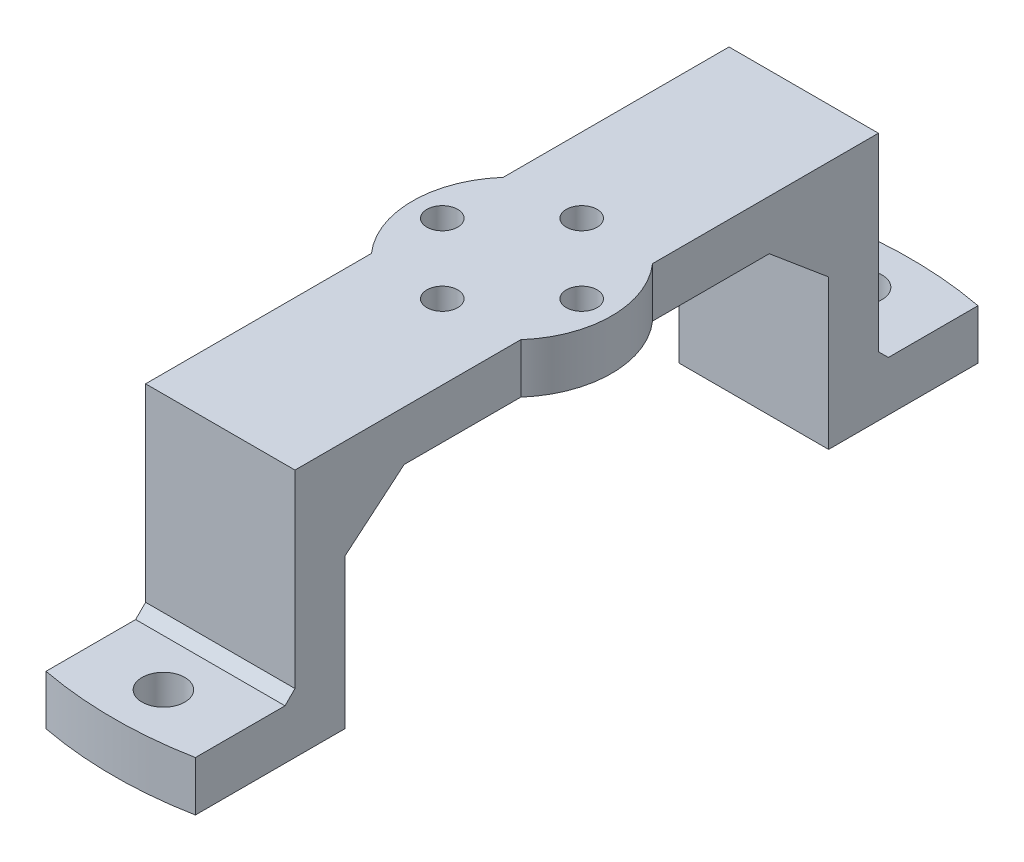
from build123d import *
from OCP.BRepFilletAPI import BRepFilletAPI_MakeChamfer

# Parameters (mm, degrees)
SKETCH1_R             = 2.15
BOSS_EXTRUDE1_DEPTH   = 5
BOSS_EXTRUDE1_2_DEPTH = 5
SKETCH2_W             = 15
SKETCH2_H             = 5
BOSS_EXTRUDE2_DEPTH   = 15
SKETCH3_W             = 15
SKETCH3_H             = 58.581168228
BOSS_EXTRUDE3_DEPTH   = 5
SKETCH4_R             = 10
BOSS_EXTRUDE4_DEPTH   = 5
SKETCH5_R             = 1.55
CUT_EXTRUDE1_DEPTH    = 5
CHAMFER2_SIZE         = 5
CHAMFER2_SIZE2        = 5.958767963
CHAMFER3_SIZE         = 1


with BuildPart() as part:
    # Sketch1 → Boss-Extrude1 (new body)
    with BuildSketch(Plane(origin=(0, 0, 0), x_dir=(1, 0, 0), z_dir=(0, 1, 0))):
        with BuildLine():
            Line((-7.5, -24.290584114), (-7.5, -39.290584114))
            ThreePointArc((-7.5, -39.290584114), (0, -40), (7.5, -39.290584114))
            Line((7.5, -39.290584114), (7.5, -24.290584114))
            Line((7.5, -24.290584114), (-7.5, -24.290584114))
        make_face()
        with Locations(Location((0, -35, 0), (0, 0, 270))):
            Circle(SKETCH1_R, mode=Mode.SUBTRACT)
    extrude(amount=BOSS_EXTRUDE1_DEPTH)



with BuildPart() as body_2:
    # Sketch1 → Boss-Extrude1 2 (new body)
    with BuildSketch(Plane(origin=(0, 0, 0), x_dir=(1, 0, 0), z_dir=(0, 1, 0))):
        with BuildLine():
            Line((-7.5, 39.290584114), (-7.5, 24.290584114))
            Line((-7.5, 24.290584114), (7.5, 24.290584114))
            Line((7.5, 24.290584114), (7.5, 39.290584114))
            ThreePointArc((7.5, 39.290584114), (0, 40), (-7.5, 39.290584114))
        make_face()
        with Locations(Location((0, 35, 0), (0, 0, 270))):
            Circle(SKETCH1_R, mode=Mode.SUBTRACT)
    extrude(amount=BOSS_EXTRUDE1_2_DEPTH)


with BuildPart() as part_1:
    add(part.part)

    add(body_2.part)  # Boss-Extrude2 merges body 2
    # Sketch2 → Boss-Extrude2 (add)
    with BuildSketch(Plane(origin=(0, 5, 0), x_dir=(1, 0, 0), z_dir=(0, 1, 0))):
        with Locations((0, -26.790584114)):
            Rectangle(SKETCH2_W, SKETCH2_H)
        with Locations((0, 26.790584114)):
            Rectangle(SKETCH2_W, SKETCH2_H)
    extrude(amount=BOSS_EXTRUDE2_DEPTH)

    # Sketch3 → Boss-Extrude3 (add)
    with BuildSketch(Plane(origin=(0, 20, 0), x_dir=(1, 0, 0), z_dir=(0, 1, 0))):
        Rectangle(SKETCH3_W, SKETCH3_H)
    extrude(amount=BOSS_EXTRUDE3_DEPTH)

    # Sketch4 → Boss-Extrude4 (add)
    with BuildSketch(Plane(origin=(0, 25, 0), x_dir=(1, 0, 0), z_dir=(0, 1, 0))):
        Circle(SKETCH4_R)
    extrude(amount=-BOSS_EXTRUDE4_DEPTH)

    # Sketch5 → Cut-Extrude1 (cut)
    with BuildSketch(Plane(origin=(0, 25, 0), x_dir=(1, 0, 0), z_dir=(0, 1, 0))):
        with Locations(Location((0, 7, 0), (0, 0, 270))):
            Circle(SKETCH5_R)
        with Locations(Location((7, 0, 0), (0, 0, 270))):
            Circle(SKETCH5_R)
        with Locations(Location((0, -7, 0), (0, 0, 270))):
            Circle(SKETCH5_R)
        with Locations(Location((-7, 0, 0), (0, 0, 270))):
            Circle(SKETCH5_R)
    extrude(amount=-CUT_EXTRUDE1_DEPTH, mode=Mode.SUBTRACT)

    # Chamfer2: one chamfer whose edges measure the first distance from different faces: ONE call of the kernel's chamfer builder (chamfer() names one face for all edges)
    chamfer2_edges_1 = [part_1.edges().sort_by_distance(p)[0] for p in [
        (0, 20, -24.290584114),
    ]]
    chamfer2_side_1 = [part_1.faces().sort_by_distance(p)[0] for p in [
        (0, 10, -24.290584114),
    ]]
    chamfer2_edges_2 = [part_1.edges().sort_by_distance(p)[0] for p in [
        (0, 20, 24.290584114),
    ]]
    chamfer2_side_2 = [part_1.faces().sort_by_distance(p)[0] for p in [
        (0, 10, 24.290584114),
    ]]
    chamfer2 = BRepFilletAPI_MakeChamfer(part_1.part.solid().wrapped)
    for e in chamfer2_edges_1:
        chamfer2.Add(CHAMFER2_SIZE, CHAMFER2_SIZE2, e.wrapped, chamfer2_side_1[0].wrapped)  # the first distance lies on this face
    for e in chamfer2_edges_2:
        chamfer2.Add(CHAMFER2_SIZE, CHAMFER2_SIZE2, e.wrapped, chamfer2_side_2[0].wrapped)  # the first distance lies on this face
    add(Compound.cast(chamfer2.Shape()), mode=Mode.REPLACE)

    # Chamfer3
    chamfer3_edges = [part_1.edges().sort_by_distance(p)[0] for p in [
        (0, 5, -29.290584114),
        (0, 5, 29.290584114),
    ]]
    chamfer(chamfer3_edges, length=CHAMFER3_SIZE)


solid = part_1.part
